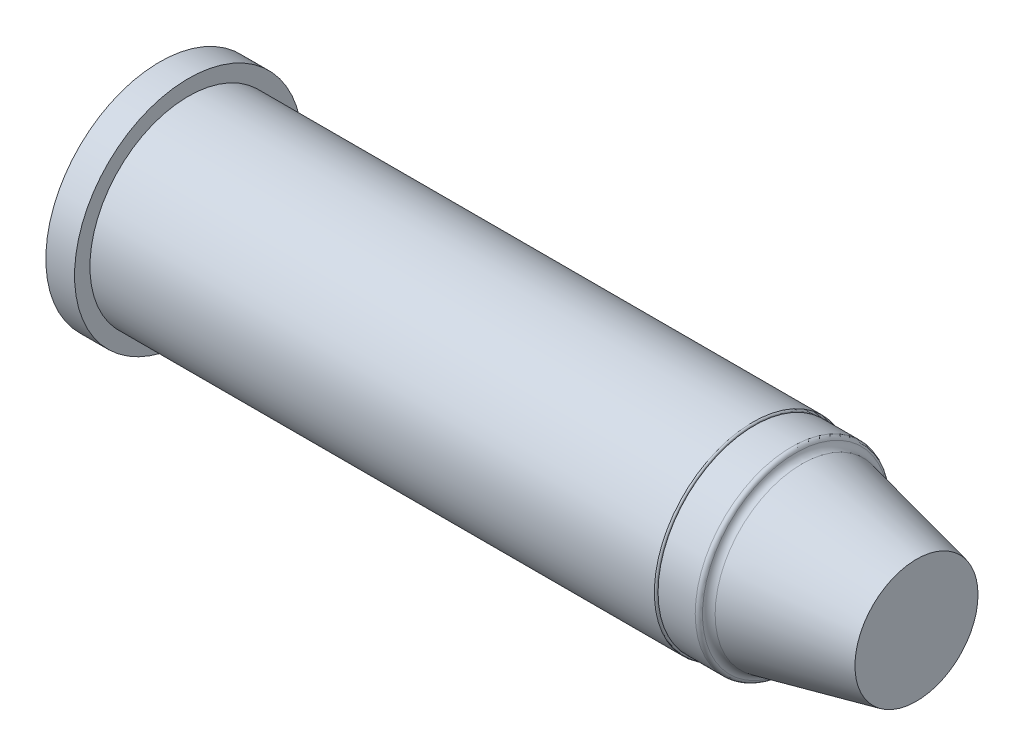
from build123d import *

# Parameters (mm, degrees)
FILETE1_R = 0.2


with BuildPart() as part:
    # Esboço1 → Revolução1 (revolve)
    with BuildSketch(Plane.XY, mode=Mode.PRIVATE) as revolu_o1_sk:
        with BuildLine():
            Line((0, 4.678862418), (0, 10.228862418))
            Line((0, 10.228862418), (1.4, 10.228862418))
            Line((1.4, 10.228862418), (1.4, 9.478862418))
            Line((1.4, 9.478862418), (28.92, 9.478862418))
            ThreePointArc((28.92, 9.478862418), (28.976568542, 9.455430961), (29, 9.398862418))
            Line((29, 9.398862418), (29, 9.378862418))
            Line((29, 9.378862418), (31, 9.378862418))
            Line((31, 9.378862418), (31, 9.300321604))
            ThreePointArc((31, 9.300321604), (31.088208078, 9.049750661), (31.313928988, 8.909691624))
            Line((31.313928988, 8.909691624), (36.9, 7.678862418))
            Line((36.9, 7.678862418), (36.9, 4.678862418))
            Line((36.9, 4.678862418), (0, 4.678862418))
        make_face()
    revolve(revolu_o1_sk.sketch.rotate(Axis((36.9, 4.678862418, 0), (-1, 0, 0)), 90), axis=Axis((36.9, 4.678862418, 0), (-1, 0, 0)))

    # Filete1
    filete1_edges = [part.edges().sort_by_distance(p)[0] for p in [
        (31, 4.678862418, 4.7),
    ]]
    fillet(filete1_edges, radius=FILETE1_R)


solid = part.part
